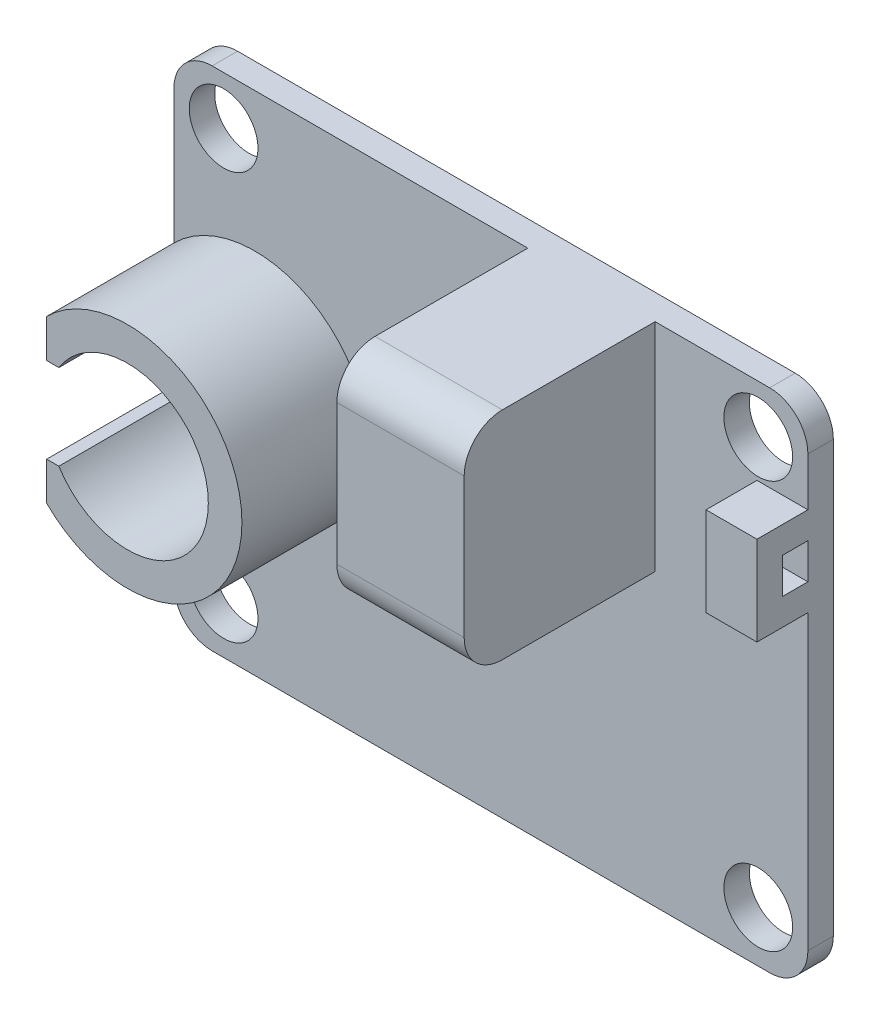
from build123d import *

# Parameters (mm, degrees)
CROQUIS1_W              = 49.8
CROQUIS1_H              = 39.8
CROQUIS1_R              = 2.7
SALIENTE_EXTRUIR1_DEPTH = 6
CORTAR_EXTRUIR1_DEPTH   = 4
REDONDEO1_R             = 3
SALIENTE_EXTRUIR3_DEPTH = 3
CROQUIS5_R              = 6.35
CORTAR_EXTRUIR2_DEPTH   = 3
SALIENTE_EXTRUIR4_DEPTH = 10
SALIENTE_EXTRUIR5_DEPTH = 2
CORTAR_EXTRUIR3_START   = -3
CORTAR_EXTRUIR3_DEPTH   = 3
CORTAR_EXTRUIR4_DEPTH   = 4
CROQUIS10_W             = 4
CROQUIS10_H             = 7
SALIENTE_EXTRUIR6_DEPTH = 4
CORTAR_EXTRUIR5_DEPTH   = 4
CROQUIS16_W             = 28.958796265
CROQUIS16_H             = 47.870649268
CORTAR_EXTRUIR6_DEPTH   = 2
CROQUIS17_W             = 5
CROQUIS17_H             = 16
CORTAR_EXTRUIR7_DEPTH   = 10
CORTAR_EXTRUIR8_DEPTH   = 2
SALIENTE_EXTRUIR7_DEPTH = 10
CROQUIS21_W             = 10
CROQUIS21_H             = 17
SALIENTE_EXTRUIR8_DEPTH = 15
CROQUIS22_R             = 7
CORTAR_EXTRUIR9_DEPTH   = 8
REDONDEO2_R             = 3


with BuildPart() as part:
    # Croquis1 → Saliente-Extruir1 (new body)
    with BuildSketch(Plane.XY):
        with Locations((-31.963412372, -3.757931034)):
            Rectangle(CROQUIS1_W, CROQUIS1_H)
        with Locations((-52.963412372, 12.342068966)):
            Circle(CROQUIS1_R, mode=Mode.SUBTRACT)
        with Locations((-10.963412372, 12.342068966)):
            Circle(CROQUIS1_R, mode=Mode.SUBTRACT)
        with Locations((-10.963412372, -19.657931034)):
            Circle(CROQUIS1_R, mode=Mode.SUBTRACT)
        with Locations((-52.963412372, -19.657931034)):
            Circle(CROQUIS1_R, mode=Mode.SUBTRACT)
    extrude(amount=SALIENTE_EXTRUIR1_DEPTH)

    # Croquis2 → Cortar-Extruir1 (cut)
    with BuildSketch(Plane.XY.offset(6)):
        with BuildLine():
            Line((-49.963412372, -16.757931034), (-13.963412372, -16.757931034))
            ThreePointArc((-13.963412372, -16.757931034), (-12.54919881, -16.172144597), (-11.963412372, -14.757931034))
            Line((-11.963412372, -14.757931034), (-11.963412372, 7.242068966))
            ThreePointArc((-11.963412372, 7.242068966), (-12.54919881, 8.656282528), (-13.963412372, 9.242068966))
            Line((-13.963412372, 9.242068966), (-49.963412372, 9.242068966))
            ThreePointArc((-49.963412372, 9.242068966), (-51.377625934, 8.656282528), (-51.963412372, 7.242068966))
            Line((-51.963412372, 7.242068966), (-51.963412372, -14.757931034))
            ThreePointArc((-51.963412372, -14.757931034), (-51.377625934, -16.172144597), (-49.963412372, -16.757931034))
        make_face()
    extrude(amount=-CORTAR_EXTRUIR1_DEPTH, mode=Mode.SUBTRACT)

    # Redondeo1
    redondeo1_edges = [part.edges().sort_by_distance(p)[0] for p in [
        (-56.863412372, 16.142068966, 3),
        (-7.063412372, 16.142068966, 3),
        (-7.063412372, -23.657931034, 3),
        (-56.863412372, -23.657931034, 3),
    ]]
    fillet(redondeo1_edges, radius=REDONDEO1_R)

    # Croquis4 → Saliente-Extruir3 (add)
    with BuildSketch(Plane(origin=(0, 0, 0), x_dir=(-1, 0, 0), z_dir=(0, 0, -1))):
        with BuildLine():
            Line((56.863412372, 4.242068966), (61.863412372, 4.242068966))
            Line((61.863412372, 4.242068966), (61.863412372, -0.257931034))
            Line((61.863412372, -0.257931034), (57.863412372, -0.257931034))
            ThreePointArc((57.863412372, -0.257931034), (57.358118834, -0.294597605), (56.863412372, -0.403829068))
            Line((56.863412372, -0.403829068), (56.863412372, 4.242068966))
        make_face()
        with BuildLine():
            Line((61.863412372, -11.757931034), (56.863412372, -11.757931034))
            Line((56.863412372, -11.757931034), (56.863412372, -7.112033001))
            ThreePointArc((56.863412372, -7.112033001), (57.358118834, -7.221264464), (57.863412372, -7.257931034))
            Line((57.863412372, -7.257931034), (61.863412372, -7.257931034))
            Line((61.863412372, -7.257931034), (61.863412372, -11.757931034))
        make_face()
    extrude(amount=-SALIENTE_EXTRUIR3_DEPTH)

    # Croquis5 → Cortar-Extruir2 (cut)
    with BuildSketch(Plane.XY.offset(3)):
        with Locations((-57.863412372, -3.757931034)):
            Circle(CROQUIS5_R)
    extrude(amount=CORTAR_EXTRUIR2_DEPTH, mode=Mode.SUBTRACT)

    # Croquis6 → Saliente-Extruir4 (add)
    with BuildSketch(Plane.XY.offset(3)):
        with BuildLine():
            Line((-61.863412372, 4.242068966), (-51.963412372, 4.242068966))
            Line((-51.963412372, 4.242068966), (-48.963412372, 4.242068966))
            Line((-48.963412372, 4.242068966), (-48.963412372, -11.757931034))
            Line((-48.963412372, -11.757931034), (-51.963412372, -11.757931034))
            Line((-51.963412372, -11.757931034), (-61.863412372, -11.757931034))
            Line((-61.863412372, -11.757931034), (-61.863412372, -8.689715701))
            ThreePointArc((-61.863412372, -8.689715701), (-51.513412372, -3.757931034), (-61.863412372, 1.173853632))
            Line((-61.863412372, 1.173853632), (-61.863412372, 4.242068966))
        make_face()
    extrude(amount=SALIENTE_EXTRUIR4_DEPTH)

    # Croquis7 → Saliente-Extruir5 (add)
    with BuildSketch(Plane.XY.offset(2)):
        Polygon((-51.963412372, -3.757931034), (-51.963412372, 4.242068966), (-48.963412372, 4.242068966), (-48.963412372, -11.757931034), (-51.963412372, -11.757931034), align=None)
    extrude(amount=SALIENTE_EXTRUIR5_DEPTH)

    # Croquis8 → Cortar-Extruir3 (cut)
    with BuildSketch(Plane.XY.offset(3).offset(CORTAR_EXTRUIR3_START)):
        with BuildLine():
            Line((-56.863412372, -0.403829068), (-56.863412372, -7.112033001))
            ThreePointArc((-56.863412372, -7.112033001), (-53.509310406, -3.757931034), (-56.863412372, -0.403829068))
        make_face()
    extrude(amount=CORTAR_EXTRUIR3_DEPTH, mode=Mode.SUBTRACT)

    # Croquis9 → Cortar-Extruir4 (cut)
    with BuildSketch(Plane.XY.offset(6)):
        Polygon((-56.863412372, -11.757931034), (-56.863412372, -27.492217147), (-1.817084798, -27.492217147), (-1.817084798, 22.861833321), (-56.863412372, 22.861833321), (-56.863412372, 4.242068966), (-47.172737702, 4.242068966), (-47.172737702, -11.757931034), align=None)
    extrude(amount=-CORTAR_EXTRUIR4_DEPTH, mode=Mode.SUBTRACT)

    # Croquis10 → Saliente-Extruir6 (add)
    with BuildSketch(Plane.XY.offset(2)):
        with Locations((-9.063412372, 5.842068966)):
            Rectangle(CROQUIS10_W, CROQUIS10_H)
    extrude(amount=SALIENTE_EXTRUIR6_DEPTH)

    # Croquis11 → Cortar-Extruir5 (cut)
    with BuildSketch(Plane(origin=(-7.063412372, 0, 0), x_dir=(0, 0, -1), z_dir=(1, 0, 0))):
        Polygon((-2, 5.842068966), (-2, 7.242068966), (-4, 7.242068966), (-4, 4.442068966), (-2, 4.442068966), align=None)
    extrude(amount=-CORTAR_EXTRUIR5_DEPTH, mode=Mode.SUBTRACT)

    # Croquis16 → Cortar-Extruir6 (cut)
    with BuildSketch(Plane.XY.offset(2)):
        with Locations((-49.718694927, -6.990346687)):
            Rectangle(CROQUIS16_W, CROQUIS16_H)
    extrude(amount=CORTAR_EXTRUIR6_DEPTH, mode=Mode.SUBTRACT)


with BuildPart() as cortar_extruir6_kept_piece:
    # of the separate pieces the step leaves, the one the design keeps (cortar_extruir6_pieces_kept)
    add(part.part.solids().sort_by_distance((-53.863412372, 16.142068966, 0))[0])

    # Croquis17 → Cortar-Extruir7 (cut)
    with BuildSketch(Plane.XY.offset(2)):
        with Locations((-59.363412372, -3.757931034)):
            Rectangle(CROQUIS17_W, CROQUIS17_H)
    extrude(amount=-CORTAR_EXTRUIR7_DEPTH, mode=Mode.SUBTRACT)

    # Croquis18 → Cortar-Extruir8 (cut)
    with BuildSketch(Plane.XY.offset(2)):
        with BuildLine():
            Line((-56.863412372, -0.403829068), (-50.513412372, -0.403829068))
            ThreePointArc((-50.513412372, -0.403829068), (-47.159310406, -3.757931034), (-50.513412372, -7.112033001))
            Line((-50.513412372, -7.112033001), (-56.863412372, -7.112033001))
            Line((-56.863412372, -7.112033001), (-56.863412372, -0.403829068))
        make_face()
    extrude(amount=-CORTAR_EXTRUIR8_DEPTH, mode=Mode.SUBTRACT)

    # Croquis19 → Saliente-Extruir7 (add)
    with BuildSketch(Plane.XY.offset(2)):
        with BuildLine():
            Line((-56.863412372, -0.403829068), (-55.905304433, -0.403829068))
            ThreePointArc((-55.905304433, -0.403829068), (-48.769281441, 2.347845517), (-44.163412372, -3.757931034))
            ThreePointArc((-44.163412372, -3.757931034), (-48.769281441, -9.863707586), (-55.905304433, -7.112033001))
            Line((-55.905304433, -7.112033001), (-56.863412372, -7.112033001))
            Line((-56.863412372, -7.112033001), (-56.863412372, -10.112033001))
            ThreePointArc((-56.863412372, -10.112033001), (-41.523253228, -3.757931034), (-56.863412372, 2.596170932))
            Line((-56.863412372, 2.596170932), (-56.863412372, -0.403829068))
        make_face()
    extrude(amount=SALIENTE_EXTRUIR7_DEPTH)

    # Croquis21 → Saliente-Extruir8 (add)
    with BuildSketch(Plane.XY.offset(2)):
        with Locations((-24.063412372, 7.642068966)):
            Rectangle(CROQUIS21_W, CROQUIS21_H)
    extrude(amount=SALIENTE_EXTRUIR8_DEPTH)

    # Croquis22 → Cortar-Extruir9 (cut)
    with BuildSketch(Plane.ZY.offset(29.063412372)):
        with Locations(Location((9, 7.642068966, 0), (0, 0, 270))):
            Circle(CROQUIS22_R)
    extrude(amount=-CORTAR_EXTRUIR9_DEPTH, mode=Mode.SUBTRACT)

    # Redondeo2
    redondeo2_edges = [cortar_extruir6_kept_piece.edges().sort_by_distance(p)[0] for p in [
        (-24.063412372, 16.142068966, 17),
        (-24.063412372, -0.857931034, 17),
    ]]
    fillet(redondeo2_edges, radius=REDONDEO2_R)


solid = cortar_extruir6_kept_piece.part
